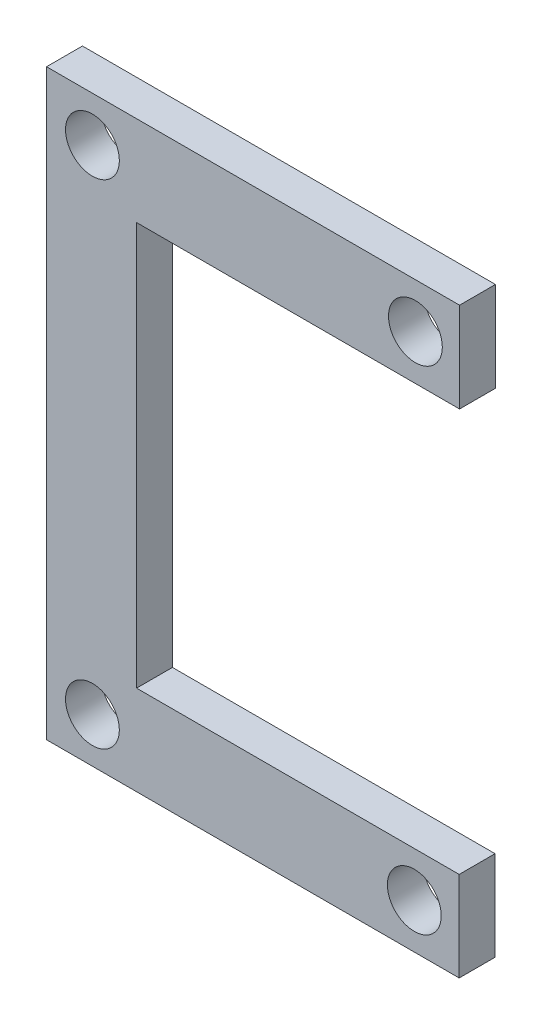
from build123d import *

# Parameters (mm, degrees)
SKETCH1_R           = 1.5
BOSS_EXTRUDE2_DEPTH = 2


with BuildPart() as part:
    # Sketch1 → Boss-Extrude2 (new body)
    with BuildSketch(Plane.XY):
        Polygon((-65.981474854, -14.534472754), (-88.998135761, -14.534472754), (-88.998135761, -47.017147389), (-66.003166269, -47.017147389), (-66.003166269, -42.017147389), (-83.981474854, -42.017147389), (-83.981474854, -19.545987886), (-65.981474854, -19.545987886), align=None)
        with Locations((-68.442781439, -17.04023032)):
            Circle(SKETCH1_R, mode=Mode.SUBTRACT)
        with Locations((-86.441521614, -17.04023032)):
            Circle(SKETCH1_R, mode=Mode.SUBTRACT)
        with Locations((-86.441521614, -44.517147389)):
            Circle(SKETCH1_R, mode=Mode.SUBTRACT)
        with Locations((-68.503166269, -44.517147389)):
            Circle(SKETCH1_R, mode=Mode.SUBTRACT)
    extrude(amount=BOSS_EXTRUDE2_DEPTH)


solid = part.part
